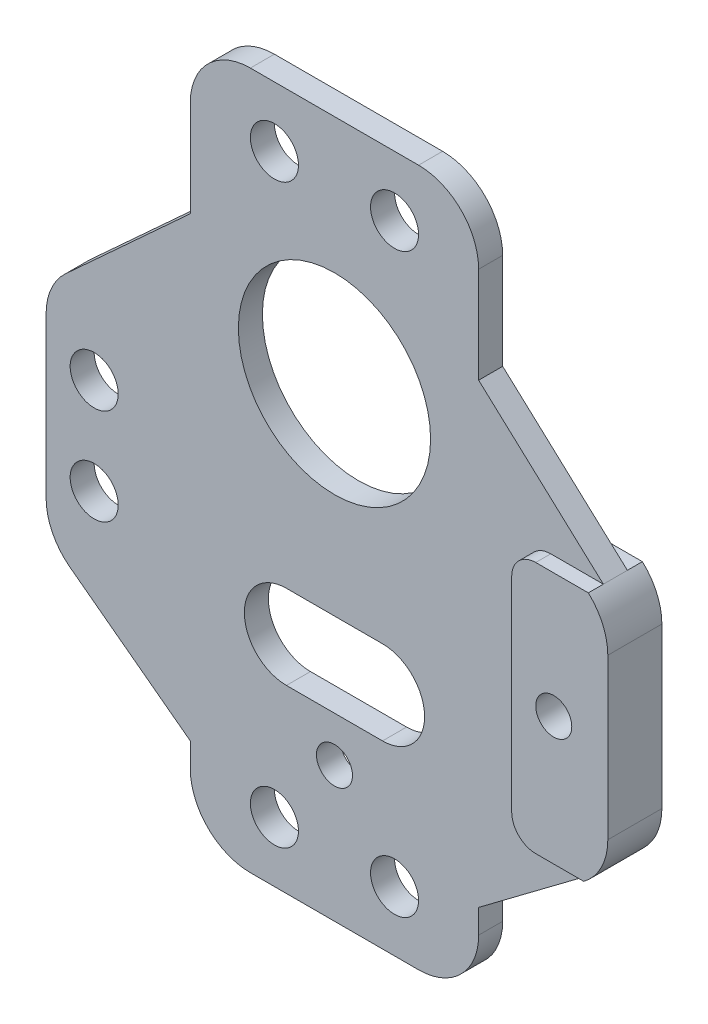
from build123d import *

# Parameters (mm, degrees)
SKETCH_1_R               = 2
SKETCH_1_R_2             = 8
SKETCH_1_R_3             = 1.5
EXTRUDE_1_DEPTH          = 2
EXTRUDE_2_DEPTH          = 3.25
CUT_EXTRUDE_1_DEPTH      = 39.603141342
CUT_EXTRUDE_1_DEPTH_BACK = 39.603141342
SKETCH_3_R               = 1.5
CUT_EXTRUDE_2_DEPTH      = 2
FILLET_1_R               = 2


with BuildPart() as part:
    # 草图1 → 凸台-拉伸1 (new body)
    with BuildSketch(Plane(origin=(0, 0, 0), x_dir=(-1, 0, 0), z_dir=(0, 0, -1))):
        with BuildLine():
            Line((-12.803038101, -22.40151905), (-12.803038101, -24.40151905))
            ThreePointArc((-12.803038101, -24.40151905), (-11.338572007, -27.937052956), (-7.803038101, -29.40151905))
            Line((-7.803038101, -29.40151905), (6.196961899, -29.40151905))
            ThreePointArc((6.196961899, -29.40151905), (9.732495805, -27.937052956), (11.196961899, -24.40151905))
            Line((11.196961899, -24.40151905), (11.196961899, -22.40151905))
            Line((11.196961899, -22.40151905), (21.196961899, -14.90151905))
            ThreePointArc((21.196961899, -14.90151905), (22.669097854, -13.137587028), (23.196961899, -10.90151905))
            Line((23.196961899, -10.90151905), (23.196961899, 2.398972368))
            ThreePointArc((23.196961899, 2.398972368), (22.773702864, 4.412288573), (21.575585042, 6.084743069))
            Line((21.575585042, 6.084743069), (11.196961899, 15.59848095))
            Line((11.196961899, 15.59848095), (11.196961899, 23.59848095))
            ThreePointArc((11.196961899, 23.59848095), (9.732495805, 27.134014855), (6.196961899, 28.59848095))
            Line((6.196961899, 28.59848095), (-7.803038101, 28.59848095))
            ThreePointArc((-7.803038101, 28.59848095), (-11.338572007, 27.134014855), (-12.803038101, 23.59848095))
            Line((-12.803038101, 23.59848095), (-12.803038101, 15.59848095))
            Line((-12.803038101, 15.59848095), (-23.181661243, 6.084743069))
            ThreePointArc((-23.181661243, 6.084743069), (-24.379779065, 4.412288573), (-24.803038101, 2.398972368))
            Line((-24.803038101, 2.398972368), (-24.803038101, -10.90151905))
            ThreePointArc((-24.803038101, -10.90151905), (-24.275174056, -13.137587028), (-22.803038101, -14.90151905))
            Line((-22.803038101, -14.90151905), (-12.803038101, -22.40151905))
        make_face()
        with Locations(Location((19.196961899, -8.40151905, 0), (0, 0, 180))):
            Circle(SKETCH_1_R, mode=Mode.SUBTRACT)
        with Locations(Location((19.196961899, -0.40151905, 0), (0, 0, 180))):
            Circle(SKETCH_1_R, mode=Mode.SUBTRACT)
        with Locations(Location((4.196961899, 23.59848095, 0), (0, 0, 180))):
            Circle(SKETCH_1_R, mode=Mode.SUBTRACT)
        with Locations(Location((-5.803038101, 23.59848095, 0), (0, 0, 180))):
            Circle(SKETCH_1_R, mode=Mode.SUBTRACT)
        with Locations(Location((-0.803038101, 9.34848095, 0), (0, 0, 180))):
            Circle(SKETCH_1_R_2, mode=Mode.SUBTRACT)
        with Locations(Location((-20.803038101, -8.40151905, 0), (0, 0, 180))):
            Circle(SKETCH_1_R, mode=Mode.SUBTRACT)
        with Locations(Location((-20.803038101, -0.40151905, 0), (0, 0, 180))):
            Circle(SKETCH_1_R, mode=Mode.SUBTRACT)
        with Locations(Location((-5.803038101, -24.40151905, 0), (0, 0, 180))):
            Circle(SKETCH_1_R, mode=Mode.SUBTRACT)
        with Locations(Location((4.196961899, -24.40151905, 0), (0, 0, 180))):
            Circle(SKETCH_1_R, mode=Mode.SUBTRACT)
        with Locations(Location((-0.803038101, -18.15151905, 0), (0, 0, 180))):
            Circle(SKETCH_1_R_3, mode=Mode.SUBTRACT)
        with BuildLine():
            Line((3.196961899, -14.40151905), (-4.803038101, -14.40151905))
            ThreePointArc((-4.803038101, -14.40151905), (-8.303038101, -10.90151905), (-4.803038101, -7.40151905))
            Line((-4.803038101, -7.40151905), (3.196961899, -7.40151905))
            ThreePointArc((3.196961899, -7.40151905), (6.696961899, -10.90151905), (3.196961899, -14.40151905))
        make_face(mode=Mode.SUBTRACT)
    extrude(amount=-EXTRUDE_1_DEPTH)

    # 草图2 → 凸台-拉伸2 (add, symmetric)
    with BuildSketch(Plane.XY.offset(2)):
        with BuildLine():
            Line((23.181661243, 6.084743069), (16.803038101, 6.084743069))
            Line((16.803038101, 6.084743069), (16.803038101, -14.90151905))
            Line((16.803038101, -14.90151905), (22.803038101, -14.90151905))
            ThreePointArc((22.803038101, -14.90151905), (24.275174056, -13.137587028), (24.803038101, -10.90151905))
            Line((24.803038101, -10.90151905), (24.803038101, 2.398972368))
            ThreePointArc((24.803038101, 2.398972368), (24.379779065, 4.412288573), (23.181661243, 6.084743069))
        make_face()
    extrude(amount=EXTRUDE_2_DEPTH, both=True)

    # 草图3 → 切除-拉伸1 (cut, two sides: drawn at the far end of the back side and taken through both)
    with BuildSketch(Plane.XY.offset(2).offset(-CUT_EXTRUDE_1_DEPTH_BACK)):
        with Locations((20.303038101, -4.251273341)):
            Circle(SKETCH_3_R)
    extrude(amount=CUT_EXTRUDE_1_DEPTH + CUT_EXTRUDE_1_DEPTH_BACK, mode=Mode.SUBTRACT)

    # 草图4 → 切除-拉伸2 (cut)
    with BuildSketch(Plane.XY.offset(5.25)):
        with BuildLine():
            Line((23.181661243, 6.084743069), (16.803038101, 6.084743069))
            Line((16.803038101, 6.084743069), (16.803038101, -14.90151905))
            Line((16.803038101, -14.90151905), (22.803038101, -14.90151905))
            ThreePointArc((22.803038101, -14.90151905), (24.275174056, -13.137587028), (24.803038101, -10.90151905))
            Line((24.803038101, -10.90151905), (24.803038101, 2.398972368))
            ThreePointArc((24.803038101, 2.398972368), (24.379779065, 4.412288573), (23.181661243, 6.084743069))
        make_face()
    extrude(amount=-CUT_EXTRUDE_2_DEPTH, mode=Mode.SUBTRACT)

    # 圆角1
    fillet_1_edges = [part.edges().sort_by_distance(p)[0] for p in [
        (16.803038101, -14.90151905, 2.625),
        (16.803038101, 6.084743069, 2.625),
        (16.803038101, -14.90151905, -0.625),
        (16.803038101, 6.084743069, -0.625),
    ]]
    fillet(fillet_1_edges, radius=FILLET_1_R)


solid = part.part
